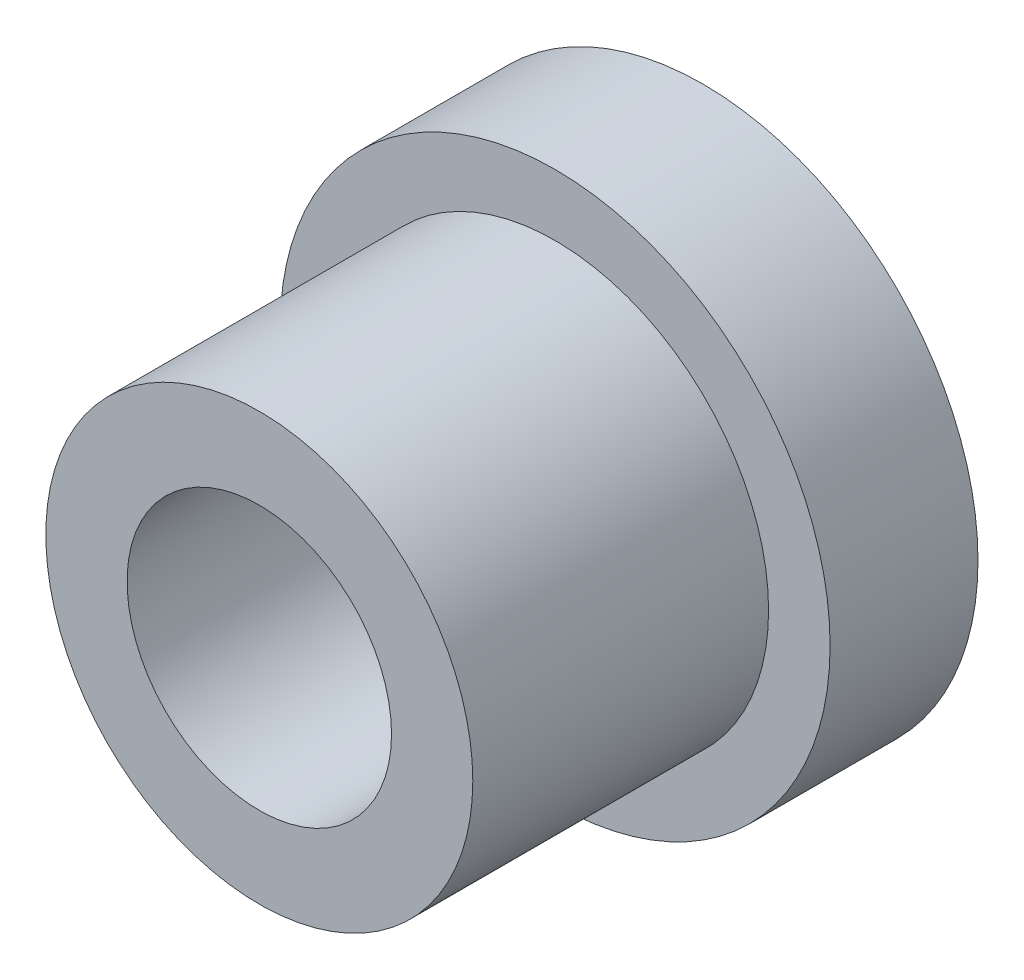
from build123d import *

# Parameters (mm, degrees)
SKETCH1_R           = 7.217490794
SKETCH1_R_2         = 4.47
BOSS_EXTRUDE1_DEPTH = 10
SKETCH2_R           = 9.29699824
BOSS_EXTRUDE2_DEPTH = 5


with BuildPart() as part:
    # Sketch1 → Boss-Extrude1 (new body)
    with BuildSketch(Plane.XY):
        Circle(SKETCH1_R)
        Circle(SKETCH1_R_2, mode=Mode.SUBTRACT)
    extrude(amount=BOSS_EXTRUDE1_DEPTH)

    # Sketch2 → Boss-Extrude2 (add)
    with BuildSketch(Plane(origin=(0, 0, 0), x_dir=(-1, 0, 0), z_dir=(0, 0, -1))):
        Circle(SKETCH2_R)
    extrude(amount=BOSS_EXTRUDE2_DEPTH)


solid = part.part
